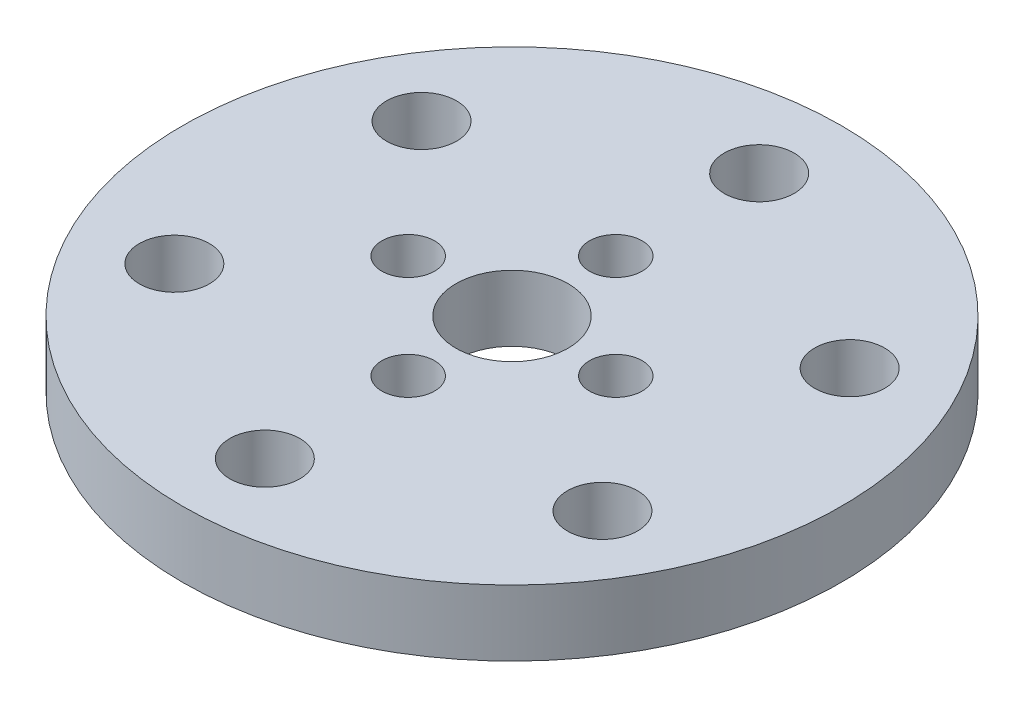
from build123d import *

# Parameters (mm, degrees)
SKETCH1_R           = 25.4
BOSS_EXTRUDE1_DEPTH = 5.08
SKETCH2_R           = 2.69875
CUT_EXTRUDE1_DEPTH  = 5.08
SKETCH3_R           = 4.318
SKETCH3_R_2         = 2.032
CUT_EXTRUDE2_DEPTH  = 5.08


with BuildPart() as part:
    # Sketch1 → Boss-Extrude1 (new body)
    with BuildSketch(Plane(origin=(0, 0, 0), x_dir=(1, 0, 0), z_dir=(0, 1, 0))):
        with Locations(Location((0, 0, 0), (0, 0, 270))):
            Circle(SKETCH1_R)
    extrude(amount=BOSS_EXTRUDE1_DEPTH)

    # Sketch2 → Cut-Extrude1 (cut)
    with BuildSketch(Plane(origin=(0, 5.08, 0), x_dir=(1, 0, 0), z_dir=(0, 1, 0))):
        with Locations(Location((0, -19.05, 0), (0, 0, 270))):
            Circle(SKETCH2_R)
        with Locations(Location((-16.497783942, -9.525, 0), (0, 0, 270))):
            Circle(SKETCH2_R)
        with Locations(Location((-16.497783942, 9.525, 0), (0, 0, 270))):
            Circle(SKETCH2_R)
        with Locations(Location((0, 19.05, 0), (0, 0, 270))):
            Circle(SKETCH2_R)
        with Locations(Location((16.497783942, 9.525, 0), (0, 0, 270))):
            Circle(SKETCH2_R)
        with Locations(Location((16.497783942, -9.525, 0), (0, 0, 270))):
            Circle(SKETCH2_R)
    extrude(amount=-CUT_EXTRUDE1_DEPTH, mode=Mode.SUBTRACT)

    # Sketch3 → Cut-Extrude2 (cut)
    with BuildSketch(Plane.XZ):
        with Locations(Location((0, 0, 0), (0, 0, 270))):
            Circle(SKETCH3_R)
        with Locations(Location((0, -8.001, 0), (0, 0, 270))):
            Circle(SKETCH3_R_2)
        with Locations(Location((-8.001, 0, 0), (0, 0, 270))):
            Circle(SKETCH3_R_2)
        with Locations(Location((0, 8.001, 0), (0, 0, 270))):
            Circle(SKETCH3_R_2)
        with Locations(Location((8.001, 0, 0), (0, 0, 270))):
            Circle(SKETCH3_R_2)
    extrude(amount=-CUT_EXTRUDE2_DEPTH, mode=Mode.SUBTRACT)


solid = part.part
